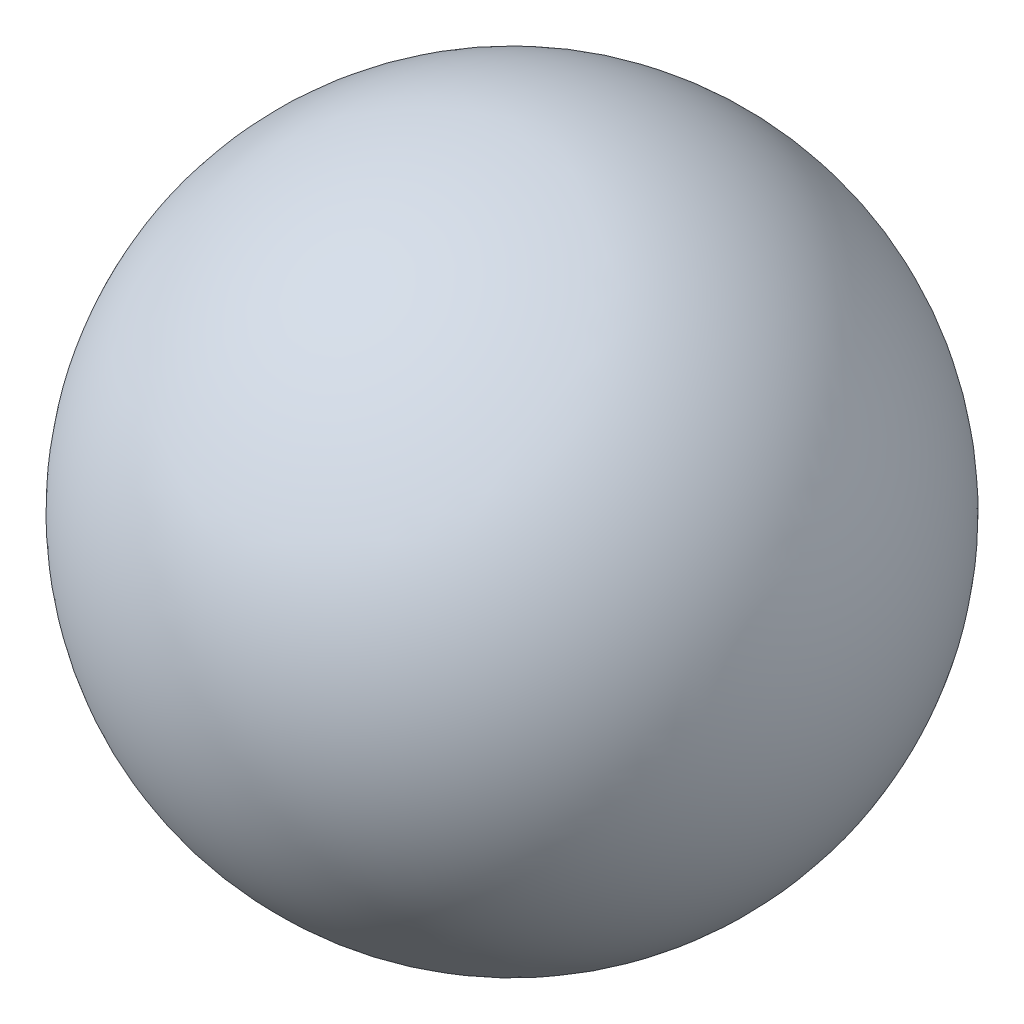
from build123d import *


with BuildPart() as part:
    # Sketch3 → Revolve2 (revolve)
    with BuildSketch(Plane(origin=(0, 0, 0), x_dir=(1, 0, 0), z_dir=(0, 1, 0))):
        with BuildLine():
            Line((-19.05, 0), (19.05, 0))
            ThreePointArc((19.05, 0), (0, 19.05), (-19.05, 0))
        make_face()
    revolve(axis=Axis((-19.05, 0, 0), (1, 0, 0)))


solid = part.part
